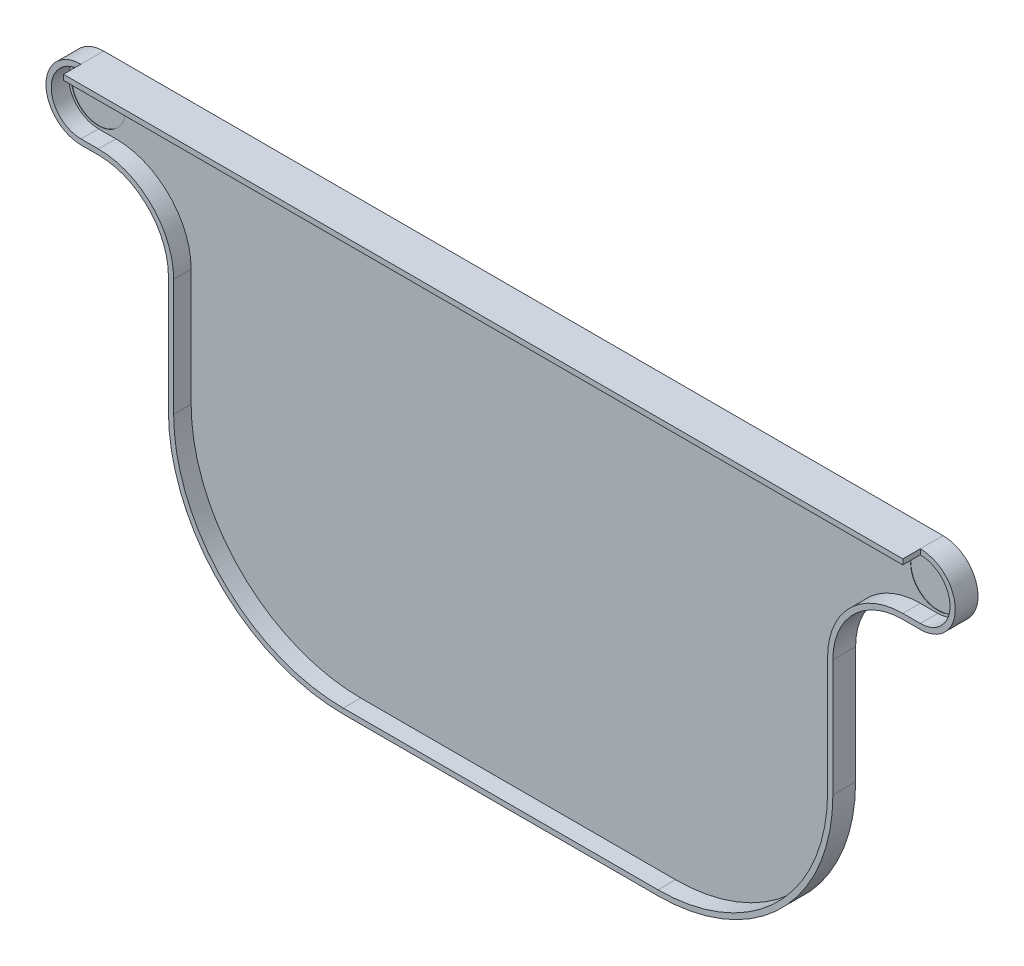
from build123d import *

# Parameters (mm, degrees)
BOSS_EXTRUDE1_DEPTH = 3
SKETCH2_W           = 480
SKETCH2_H           = 3
BOSS_EXTRUDE2_DEPTH = 20
SKETCH3_R           = 15.5
CUT_EXTRUDE1_DEPTH  = 0.2
SKETCH4_W           = 10
SKETCH4_H           = 3


with BuildPart() as part:
    # Sketch1 → Boss-Extrude1 (new body)
    with BuildSketch(Plane.XY):
        with BuildLine():
            Line((-240, -28.085620227), (-230, -28.085620227))
            ThreePointArc((-230, -28.085620227), (-201.715728753, -39.80134898), (-190, -68.085620227))
            Line((-190, -68.085620227), (-190, -135))
            ThreePointArc((-190, -135), (-160.710678119, -205.710678119), (-90, -235))
            Line((-90, -235), (90, -235))
            ThreePointArc((90, -235), (160.710678119, -205.710678119), (190, -135))
            Line((190, -135), (190, -68.085620227))
            ThreePointArc((190, -68.085620227), (201.715728753, -39.80134898), (230, -28.085620227))
            Line((230, -28.085620227), (240, -28.085620227))
            ThreePointArc((240, -28.085620227), (260, -8.085620227), (240, 11.914379773))
            Line((240, 11.914379773), (-240, 11.914379773))
            ThreePointArc((-240, 11.914379773), (-260, -8.085620227), (-240, -28.085620227))
        make_face()
    extrude(amount=BOSS_EXTRUDE1_DEPTH)

    # Sketch2 → Boss-Extrude2 (add)
    with BuildSketch(Plane.XY.offset(3)):
        with Locations((0, 10.414379773)):
            Rectangle(SKETCH2_W, SKETCH2_H)
    extrude(amount=BOSS_EXTRUDE2_DEPTH)

    # Sketch3 → Cut-Extrude1 (cut)
    with BuildSketch(Plane.XY.offset(3)):
        with Locations((-240, -8.085620227)):
            Circle(SKETCH3_R)
        with Locations(Location((240, -8.085620227, 0), (0, 0, 180))):
            Circle(SKETCH3_R)
    extrude(amount=-CUT_EXTRUDE1_DEPTH, mode=Mode.SUBTRACT)

    # Sweep1: sweep along a path in Sketch5
    with BuildLine(Plane.XY.offset(3)) as sweep1_path:
        ThreePointArc((-240, 11.914379773), (-260, -8.085620227), (-240, -28.085620227))
        Line((-240, -28.085620227), (-230, -28.085620227))
        ThreePointArc((-230, -28.085620227), (-201.715728753, -39.80134898), (-190, -68.085620227))
        Line((-190, -68.085620227), (-190, -135))
        ThreePointArc((-190, -135), (-160.710678119, -205.710678119), (-90, -235))
        Line((-90, -235), (90, -235))
        ThreePointArc((90, -235), (160.710678119, -205.710678119), (190, -135))
        Line((190, -135), (190, -68.085620227))
        ThreePointArc((190, -68.085620227), (201.715728753, -39.80134898), (230, -28.085620227))
        Line((230, -28.085620227), (240, -28.085620227))
        ThreePointArc((240, -28.085620227), (260, -8.085620227), (240, 11.914379773))
    # Sketch4 → Sweep1 (sweep)
    with BuildSketch(Plane.ZY.offset(240)):
        with Locations((8, 10.414379773)):
            Rectangle(SKETCH4_W, SKETCH4_H)
    sweep(path=sweep1_path.line)


solid = part.part
